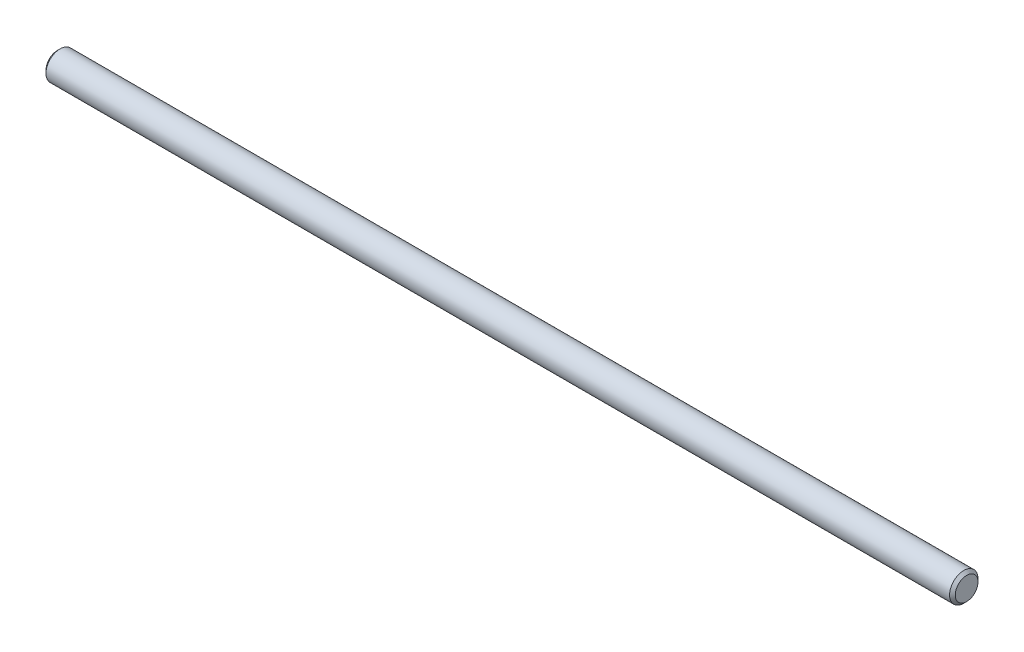
from build123d import *

# Parameters (mm, degrees)
EXTRUDE1_DEPTH      = 101.6
EXTRUDE1_DEPTH_BACK = 101.6
SKETCH2_R           = 3.175
CHAMFER1_SIZE       = 0.635


with BuildPart() as part:
    # Sketch2 → Extrude1 (new, two sides: drawn at the far end of the back side and taken through both)
    with BuildSketch(Plane(origin=(0, 0, 0), x_dir=(0, 0, -1), z_dir=(1, 0, 0)).offset(-EXTRUDE1_DEPTH_BACK)):
        Circle(SKETCH2_R)
    extrude(amount=EXTRUDE1_DEPTH + EXTRUDE1_DEPTH_BACK)

    # Chamfer1
    chamfer1_edges = [part.edges().sort_by_distance(p)[0] for p in [
        (-101.6, 0, 3.175),
        (101.6, 0, 3.175),
    ]]
    chamfer(chamfer1_edges, length=CHAMFER1_SIZE)


solid = part.part
